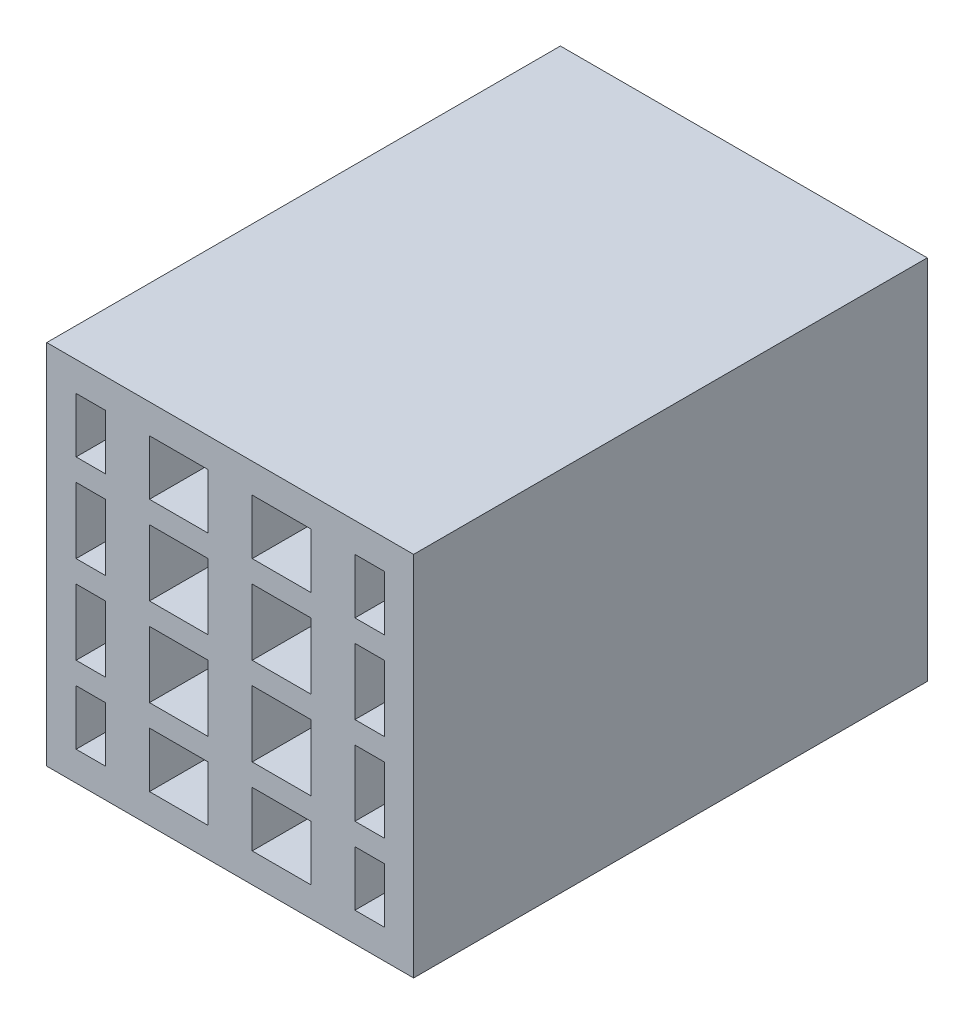
from build123d import *

# Parameters (mm, degrees)
SKETCH_8_W          = 25
SKETCH_8_H          = 25
SKETCH_8_W_2        = 4
SKETCH_8_H_2        = 21
SKETCH_8_W_3        = 2
EXTRUDE_7_DEPTH     = 25
SKETCH_9_W          = 25
SKETCH_9_H          = 25
EXTRUDE_8_DEPTH     = 2
SKETCH_11_W         = 25
SKETCH_11_H         = 25
EXTRUDE_9_DEPTH     = 6
SKETCH_12_W         = 21
SKETCH_12_H         = 21
CUT_EXTRUDE_1_DEPTH = 6
SKETCH_13_W         = 25
SKETCH_13_H         = 25
EXTRUDE_10_DEPTH    = 2
SKETCH_14_W         = 25
SKETCH_14_H         = 1.5
EXTRUDE_11_DEPTH    = 25


with BuildPart() as part:
    # 草图8 → 凸台-拉伸7 (new body)
    with BuildSketch(Plane.XY):
        Rectangle(SKETCH_8_W, SKETCH_8_H)
        with Locations((3.5, 0)):
            Rectangle(SKETCH_8_W_2, SKETCH_8_H_2, mode=Mode.SUBTRACT)
        with Locations((-3.5, 0)):
            Rectangle(SKETCH_8_W_2, SKETCH_8_H_2, mode=Mode.SUBTRACT)
        with Locations((-9.5, 0)):
            Rectangle(SKETCH_8_W_3, SKETCH_8_H_2, mode=Mode.SUBTRACT)
        with Locations((9.5, 0)):
            Rectangle(SKETCH_8_W_3, SKETCH_8_H_2, mode=Mode.SUBTRACT)
    extrude(amount=EXTRUDE_7_DEPTH)

    # 草图9 → 凸台-拉伸8 (add)
    with BuildSketch(Plane(origin=(0, 0, 0), x_dir=(-1, 0, 0), z_dir=(0, 0, -1))):
        Rectangle(SKETCH_9_W, SKETCH_9_H)
    extrude(amount=EXTRUDE_8_DEPTH)

    # 草图11 → 凸台-拉伸9 (add)
    with BuildSketch(Plane(origin=(0, 0, -2), x_dir=(-1, 0, 0), z_dir=(0, 0, -1))):
        Rectangle(SKETCH_11_W, SKETCH_11_H)
    extrude(amount=EXTRUDE_9_DEPTH)

    # 草图12 → 切除-拉伸1 (cut)
    with BuildSketch(Plane(origin=(0, 0, -8), x_dir=(-1, 0, 0), z_dir=(0, 0, -1))):
        Rectangle(SKETCH_12_W, SKETCH_12_H)
    extrude(amount=-CUT_EXTRUDE_1_DEPTH, mode=Mode.SUBTRACT)

    # 草图13 → 凸台-拉伸10 (add)
    with BuildSketch(Plane(origin=(0, 0, -8), x_dir=(-1, 0, 0), z_dir=(0, 0, -1))):
        Rectangle(SKETCH_13_W, SKETCH_13_H)
    extrude(amount=EXTRUDE_10_DEPTH)

    # 草图14 → 凸台-拉伸11 (add)
    with BuildSketch(Plane.XY.offset(25)):
        Rectangle(SKETCH_14_W, SKETCH_14_H)
        with Locations((0, 6)):
            Rectangle(SKETCH_14_W, SKETCH_14_H)
        with Locations((0, -6)):
            Rectangle(SKETCH_14_W, SKETCH_14_H)
    extrude(amount=-EXTRUDE_11_DEPTH)


solid = part.part
